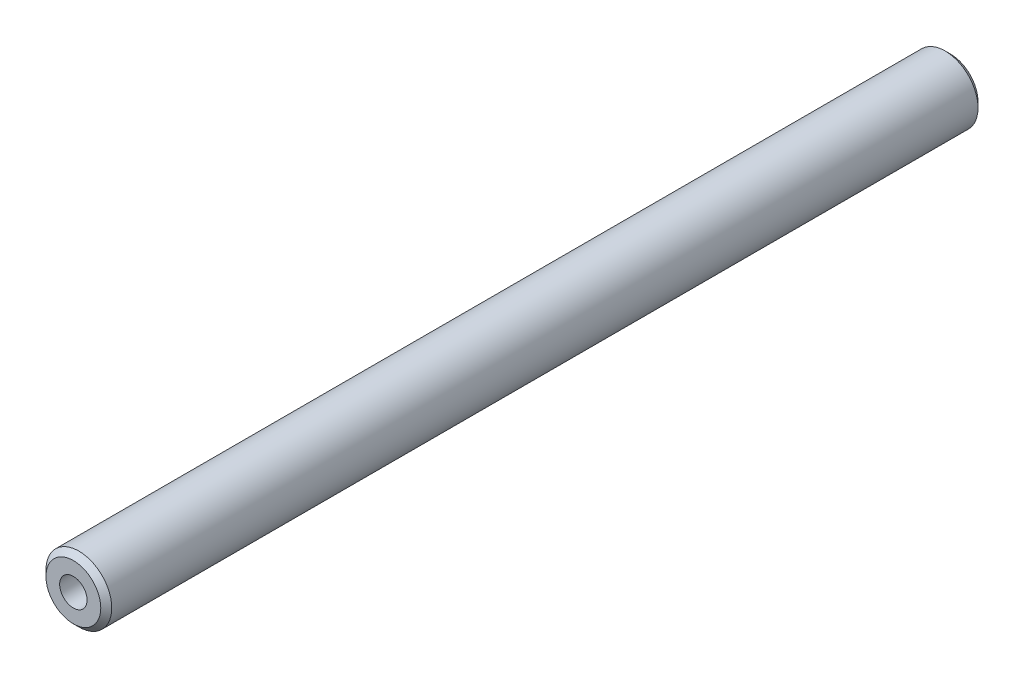
from build123d import *

# Parameters (mm, degrees)
SKETCH_1_R      = 3
EXTRUDE_1_DEPTH = 40
CHAMFER_1_SIZE  = 0.5


with BuildPart() as part:
    # ｽｹｯﾁ1 → ﾎﾞｽ - 押し出し1 (new, symmetric)
    with BuildSketch(Plane.XY):
        Circle(SKETCH_1_R)
    extrude(amount=EXTRUDE_1_DEPTH, both=True)

    # 面取り1
    chamfer_1_edges = [part.edges().sort_by_distance(p)[0] for p in [
        (-3, 0, -40),
        (-3, 0, 40),
    ]]
    chamfer(chamfer_1_edges, length=CHAMFER_1_SIZE)

    # ｽｹｯﾁ3 → M3 ねじ穴1 (revolve, cut)
    with BuildSketch(Plane(origin=(0, 0, 40), x_dir=(0, -1, 0), z_dir=(1, 0, 0))):
        Polygon((0, 0), (0, 9.251075774), (1.25, 8.5), (1.25, 0), align=None)
    hole_wizard_m3_1 = revolve(axis=Axis((0, 0, 46.35), (0, 0, -1)), mode=Mode.SUBTRACT)

    # ﾐﾗｰ1: M3 ねじ穴1 across plane
    add(hole_wizard_m3_1.mirror(Plane.XY), mode=Mode.SUBTRACT)


solid = part.part
